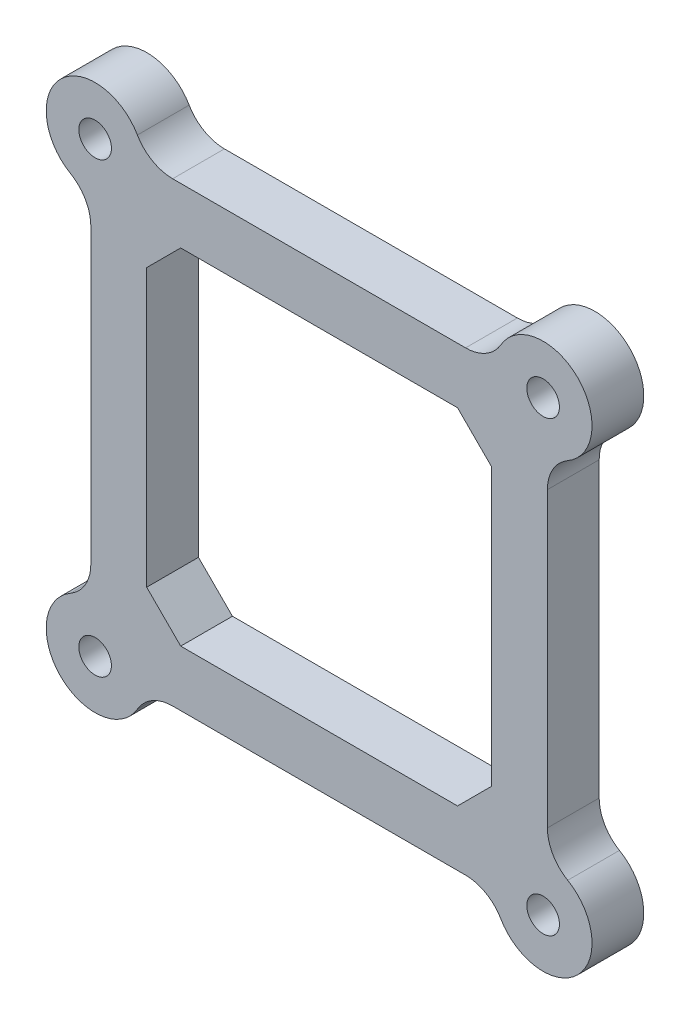
from build123d import *

# Parameters (mm, degrees)
BOSS_EXTRU_2_DEPTH        = 6.35
ESQUISSE29_R              = 6
BOSS_EXTRU_3_DEPTH        = 6.35
SYM_TRIE2_COPY_1_SKETCH_R = 6
SYM_TRIE2_COPY_1_DEPTH    = 6.35
ESQUISSE30_R              = 2
ENL_V_MAT_EXTRU_1_DEPTH   = 48.7671004
CONG_1_R                  = 5


with BuildPart() as part:
    # Esquisse28 → Boss.-Extru.2 (new body)
    with BuildSketch(Plane.XY):
        Polygon((-21.5, -28.005382387), (-28.005382387, -21.5), (-28.005382387, 21.5), (-21.5, 28.005382387), (21.5, 28.005382387), (28.005382387, 21.5), (28.005382387, -21.5), (21.5, -28.005382387), align=None)
        Polygon((-16.978069991, -21.15), (-21.15, -16.978069991), (-21.15, 16.978069991), (-16.978069991, 21.15), (16.978069991, 21.15), (21.15, 16.978069991), (21.15, -16.978069991), (16.978069991, -21.15), align=None, mode=Mode.SUBTRACT)
    extrude(amount=BOSS_EXTRU_2_DEPTH)

    # Esquisse29 → Boss.-Extru.3 (add)
    with BuildSketch(Plane.XY):
        with Locations((27.476658888, 27.476658888)):
            Circle(ESQUISSE29_R)
    boss_extru_3 = extrude(amount=BOSS_EXTRU_3_DEPTH)

    # Symétrie1: Boss.-Extru.3 across plane
    add(boss_extru_3.mirror(Plane(origin=(0, 0, 0), x_dir=(0, 0, 1), z_dir=(1, 0, 0))))

    # Symétrie2: Boss.-Extru.3 across plane
    add(boss_extru_3.mirror(Plane.ZX))

    # Symétrie2 copy 1 sketch → Symétrie2 copy 1 (add)
    with BuildSketch(Plane(origin=(0, 0, 0), x_dir=(-1, 0, 0), z_dir=(0, 0, 1))):
        with Locations((27.476658888, 27.476658888)):
            Circle(SYM_TRIE2_COPY_1_SKETCH_R)
    extrude(amount=SYM_TRIE2_COPY_1_DEPTH)

    # Esquisse30 → Enlèv. mat.-Extru.1 (cut, through all)
    with BuildSketch(Plane.XY.offset(6.35)):
        with Locations((-27.476658888, 27.476658888)):
            Circle(ESQUISSE30_R)
        with Locations((27.476658888, 27.476658888)):
            Circle(ESQUISSE30_R)
        with Locations((27.476658888, -27.476658888)):
            Circle(ESQUISSE30_R)
        with Locations((-27.476658888, -27.476658888)):
            Circle(ESQUISSE30_R)
    extrude(amount=-ENL_V_MAT_EXTRU_1_DEPTH, mode=Mode.SUBTRACT)

    # Congé1
    cong_1_edges = [part.edges().sort_by_distance(p)[0] for p in [
        (-21.5, -28.005382387, 3.175),
        (-28.005382387, -21.5, 3.175),
        (-28.005382387, 21.5, 3.175),
        (-21.5, 28.005382387, 3.175),
        (21.5, 28.005382387, 3.175),
        (28.005382387, 21.5, 3.175),
        (28.005382387, -21.5, 3.175),
        (21.5, -28.005382387, 3.175),
    ]]
    fillet(cong_1_edges, radius=CONG_1_R)


solid = part.part
